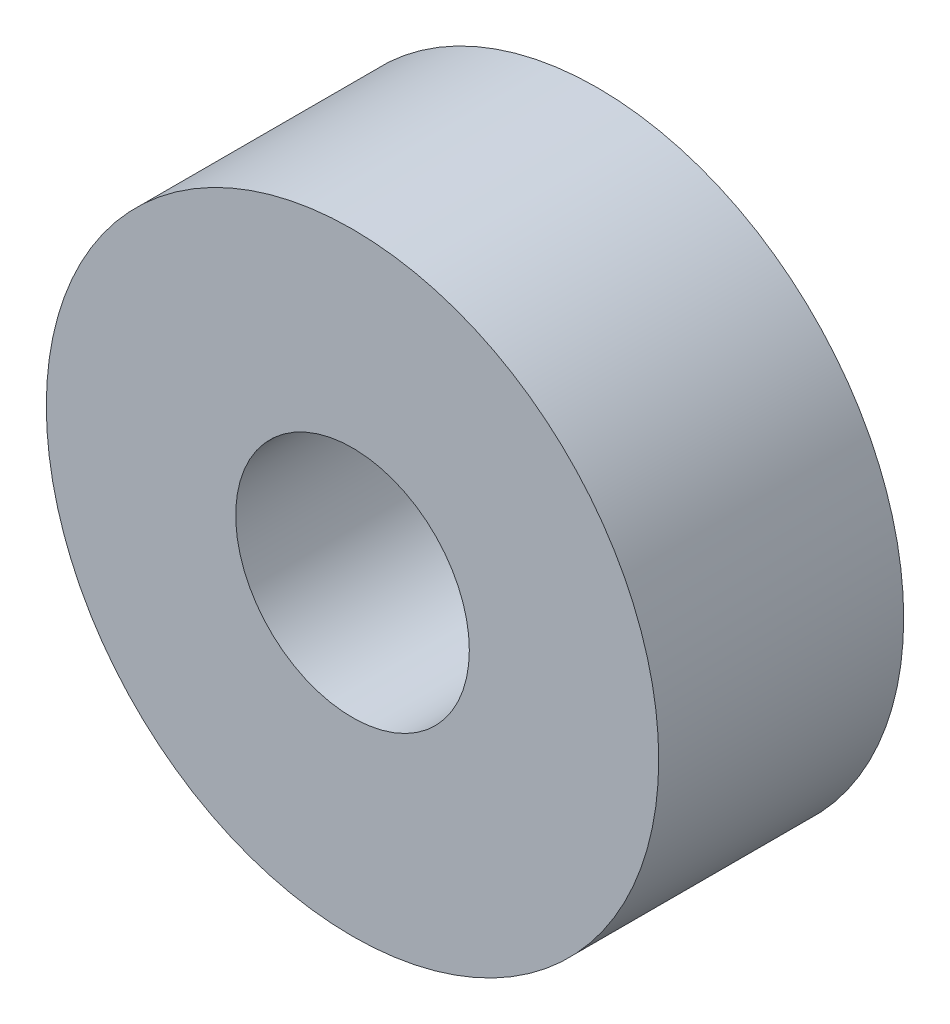
from build123d import *

# Parameters (mm, degrees)
ESBO_O1_R                = 10
RESSALTO_EXTRUS_O1_DEPTH = 8
ESBO_O2_R                = 3.815
CORTE_EXTRUS_O1_DEPTH    = 17.248076809


with BuildPart() as part:
    # Esboço1 → Ressalto-extrusão1 (new body)
    with BuildSketch(Plane.XY):
        Circle(ESBO_O1_R)
    extrude(amount=RESSALTO_EXTRUS_O1_DEPTH)

    # Esboço2 → Corte-extrusão1 (cut, through all)
    with BuildSketch(Plane.XY.offset(8)):
        Circle(ESBO_O2_R)
    extrude(amount=-CORTE_EXTRUS_O1_DEPTH, mode=Mode.SUBTRACT)


solid = part.part
